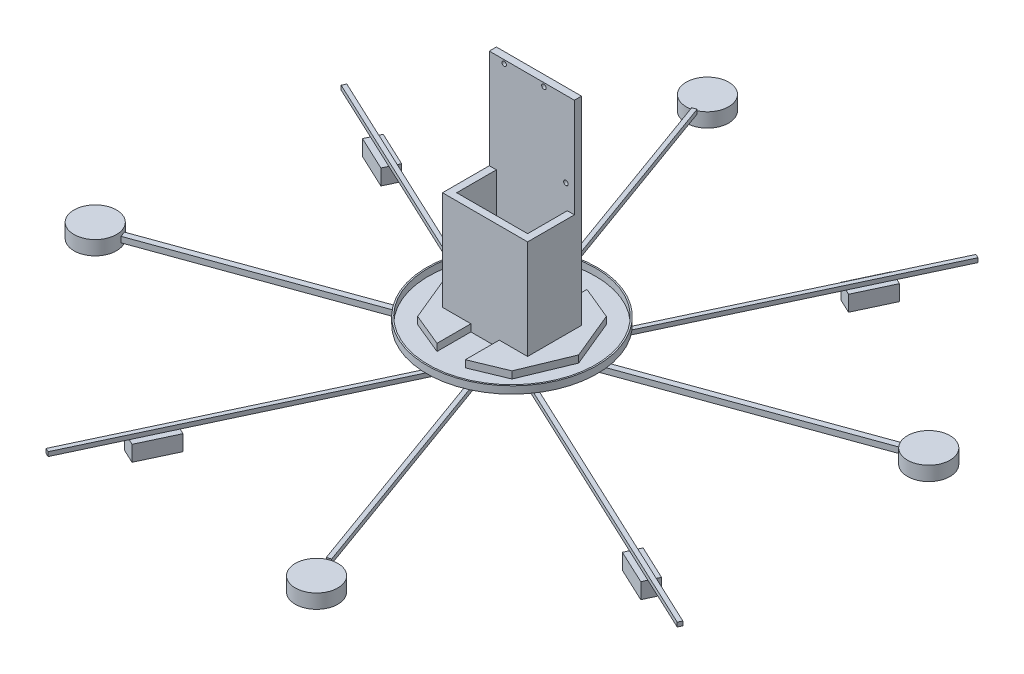
from build123d import *

# Parameters (mm, degrees)
CROQUIS1_W                 = 56
CROQUIS1_H                 = 34
CROQUIS1_W_2               = 50
CROQUIS1_H_2               = 28
SALIENTE_EXTRUIR1_DEPTH    = 5
CROQUIS2_W                 = 60
CROQUIS2_H                 = 38
CROQUIS2_W_2               = 50
CROQUIS2_H_2               = 28
SALIENTE_EXTRUIR2_DEPTH    = 70
CROQUIS4_W                 = 60
CROQUIS4_H                 = 5
SALIENTE_EXTRUIR4_DEPTH    = 70
CROQUIS5_R                 = 1.59
CORTAR_EXTRUIR1_DEPTH      = 165.203642607
CROQUIS6_W                 = 20
CROQUIS6_H                 = 30
CORTAR_EXTRUIR2_DEPTH      = 155.99942186
CROQUIS7_R                 = 60
SALIENTE_EXTRUIR5_DEPTH    = 0.1
CROQUIS9_W                 = 1
CROQUIS9_H                 = 5
SALIENTE_EXTRUIR6_DEPTH    = 0.2
SALIENTE_EXTRUIR7_DEPTH    = 22.1
CROQUIS12_W                = 3
CROQUIS12_H                = 3
SALIENTE_EXTRUIR8_DEPTH    = 197
CROQUIS13_W                = 3
CROQUIS13_H                = 3
SALIENTE_EXTRUIR9_DEPTH    = 197
CROQUIS14_W                = 4
CROQUIS14_H                = 4
SALIENTE_EXTRUIR10_DEPTH   = 197
CROQUIS15_W                = 4
CROQUIS15_H                = 4
SALIENTE_EXTRUIR12_DEPTH   = 197
CROQUIS17_R                = 15
SALIENTE_EXTRUIR13_DEPTH   = 10
SALIENTE_EXTRUIR13_2_DEPTH = 10
SALIENTE_EXTRUIR13_3_DEPTH = 10
SALIENTE_EXTRUIR13_4_DEPTH = 10
CROQUIS18_W                = 3
CROQUIS18_H                = 3
SALIENTE_EXTRUIR14_DEPTH   = 229
CROQUIS19_W                = 3
CROQUIS19_H                = 3
SALIENTE_EXTRUIR15_DEPTH   = 229
CROQUIS20_W                = 3
CROQUIS20_H                = 3
SALIENTE_EXTRUIR16_DEPTH   = 229
CROQUIS21_W                = 3
CROQUIS21_H                = 3
SALIENTE_EXTRUIR17_DEPTH   = 229
SALIENTE_EXTRUIR18_DEPTH   = 11


with BuildPart() as part:
    # Croquis1 → Saliente-Extruir1 (new body)
    # profile 1 of 3: a face of its own
    with BuildSketch(Plane(origin=(0, 0, 0), x_dir=(1, 0, 0), z_dir=(0, 1, 0))):
        Polygon((0, -47.036266736), (33.25966317, -33.25966317), (47.036266736, 0), (33.25966317, 33.25966317), (0, 47.036266736), (-33.25966317, 33.25966317), (-47.036266736, 0), (-33.25966317, -33.25966317), align=None)
        Rectangle(CROQUIS1_W, CROQUIS1_H, mode=Mode.SUBTRACT)
    # profile 2 of 3: a face of its own
    with BuildSketch(Plane(origin=(0, 0, 0), x_dir=(1, 0, 0), z_dir=(0, 1, 0))):
        Rectangle(CROQUIS1_W, CROQUIS1_H)
        Rectangle(CROQUIS1_W_2, CROQUIS1_H_2, mode=Mode.SUBTRACT)
    # profile 3 of 3: a face of its own
    with BuildSketch(Plane(origin=(0, 0, 0), x_dir=(1, 0, 0), z_dir=(0, 1, 0))):
        Rectangle(CROQUIS1_W_2, CROQUIS1_H_2)
    extrude(amount=SALIENTE_EXTRUIR1_DEPTH)

    # Croquis2 → Saliente-Extruir2 (add)
    with BuildSketch(Plane(origin=(0, 5, 0), x_dir=(1, 0, 0), z_dir=(0, 1, 0))):
        Rectangle(CROQUIS2_W, CROQUIS2_H)
        Rectangle(CROQUIS2_W_2, CROQUIS2_H_2, mode=Mode.SUBTRACT)
    extrude(amount=SALIENTE_EXTRUIR2_DEPTH)

    # Croquis4 → Saliente-Extruir4 (add)
    with BuildSketch(Plane(origin=(0, 75, 0), x_dir=(1, 0, 0), z_dir=(0, 1, 0))):
        with Locations((0, 16.5)):
            Rectangle(CROQUIS4_W, CROQUIS4_H)
    extrude(amount=SALIENTE_EXTRUIR4_DEPTH)

    # Croquis5 → Cortar-Extruir1 (cut, through all)
    with BuildSketch(Plane.XY.offset(-14)):
        with Locations((-19.5, 142.5)):
            Circle(CROQUIS5_R)
        with Locations((24, 91.5)):
            Circle(CROQUIS5_R)
        with Locations((8.5, 142.5)):
            Circle(CROQUIS5_R)
    extrude(amount=-CORTAR_EXTRUIR1_DEPTH, mode=Mode.SUBTRACT)

    # Croquis6 → Cortar-Extruir2 (cut, through all)
    with BuildSketch(Plane(origin=(0, 5, 0), x_dir=(1, 0, 0), z_dir=(0, 1, 0))):
        with Locations((0, 34)):
            Rectangle(CROQUIS6_W, CROQUIS6_H)
        with Locations((0, -34)):
            Rectangle(CROQUIS6_W, CROQUIS6_H)
    extrude(amount=-CORTAR_EXTRUIR2_DEPTH, mode=Mode.SUBTRACT)

    # Croquis7 → Saliente-Extruir5 (add)
    with BuildSketch(Plane.XZ):
        with Locations(Location((0, 0, 0), (0, 0, 270))):
            Circle(CROQUIS7_R)
    extrude(amount=SALIENTE_EXTRUIR5_DEPTH)

    # Croquis9 → Revolución1 (revolve)
    with BuildSketch(Plane.XY, mode=Mode.PRIVATE) as revoluci_n1_sk:
        with Locations((59.5, 2.5)):
            Rectangle(CROQUIS9_W, CROQUIS9_H)
    revolve(revoluci_n1_sk.sketch.rotate(Axis((0, 0, 0), (0, 1, 0)), 90), axis=Axis((0, 0, 0), (0, 1, 0)))

    # Croquis10 → Saliente-Extruir6 (add)
    with BuildSketch(Plane.XZ.offset(0.1)):
        Polygon((-21.963806256, 41.955403169), (-45.197706432, 14.136193744), (-41.955403169, -21.963806256), (-14.136193744, -45.197706432), (21.963806256, -41.955403169), (45.197706432, -14.136193744), (41.955403169, 21.963806256), (14.136193744, 45.197706432), align=None)
    extrude(amount=SALIENTE_EXTRUIR6_DEPTH)

    # Croquis11 → Saliente-Extruir7 (add)
    with BuildSketch(Plane.XZ.offset(0.3)):
        Polygon((-18.921877938, -0.869901338), (-12.764675068, -13.994901338), (0.869901338, -18.921877938), (13.994901338, -12.764675068), (18.921877938, 0.869901338), (12.764675068, 13.994901338), (-0.869901338, 18.921877938), (-13.994901338, 12.764675068), align=None)
    extrude(amount=SALIENTE_EXTRUIR7_DEPTH)

    # Croquis12 → Saliente-Extruir8 (add)
    with BuildSketch(Plane(origin=(5.947386865, 0, 16.458389638), x_dir=(0.9404794078882311, 0, -0.33985067800168073), z_dir=(0.33985067800168073, 0, 0.9404794078882311))):
        with Locations((-0.168076696, -6.9)):
            Rectangle(CROQUIS12_W, CROQUIS12_H)
    extrude(amount=SALIENTE_EXTRUIR8_DEPTH)

    # Croquis13 → Saliente-Extruir9 (add)
    with BuildSketch(Plane(origin=(-5.947386865, 0, -16.458389638), x_dir=(-0.9404794078882313, 0, 0.33985067800168045), z_dir=(-0.33985067800168045, 0, -0.9404794078882313))):
        with Locations((0.168076696, -6.9)):
            Rectangle(CROQUIS13_W, CROQUIS13_H)
    extrude(amount=SALIENTE_EXTRUIR9_DEPTH)

    # Croquis14 → Saliente-Extruir10 (add)
    with BuildSketch(Plane(origin=(-16.458389638, 0, 5.947386865), x_dir=(0.33985067800168045, 0, 0.9404794078882313), z_dir=(-0.9404794078882313, 0, 0.33985067800168045))):
        with Locations((-0.248737342, -11.4)):
            Rectangle(CROQUIS14_W, CROQUIS14_H)
    extrude(amount=SALIENTE_EXTRUIR10_DEPTH)

    # Croquis15 → Saliente-Extruir12 (add)
    with BuildSketch(Plane(origin=(16.458389638, 0, -5.947386865), x_dir=(-0.3398506780016804, 0, -0.9404794078882313), z_dir=(0.9404794078882313, 0, -0.3398506780016804))):
        with Locations((0.248737342, -11.4)):
            Rectangle(CROQUIS15_W, CROQUIS15_H)
    extrude(amount=SALIENTE_EXTRUIR12_DEPTH)

    # Croquis18 → Saliente-Extruir14 (add)
    with BuildSketch(Plane(origin=(7.432401338, 0, -15.843276503), x_dir=(-0.9053300858899115, 0, -0.4247086478782432), z_dir=(0.42470864787824314, 0, -0.9053300858899114))):
        with Locations((0, -18.9)):
            Rectangle(CROQUIS18_W, CROQUIS18_H)
    extrude(amount=SALIENTE_EXTRUIR14_DEPTH)

    # Croquis19 → Saliente-Extruir15 (add)
    with BuildSketch(Plane(origin=(-7.432401338, 0, 15.843276503), x_dir=(0.9053300858899115, 0, 0.42470864787824314), z_dir=(-0.42470864787824314, 0, 0.9053300858899115))):
        with Locations((0, -18.9)):
            Rectangle(CROQUIS19_W, CROQUIS19_H)
    extrude(amount=SALIENTE_EXTRUIR15_DEPTH)

    # Croquis20 → Saliente-Extruir16 (add)
    with BuildSketch(Plane(origin=(15.843276503, 0, 7.432401338), x_dir=(0.42470864787824314, 0, -0.9053300858899115), z_dir=(0.9053300858899115, 0, 0.42470864787824314))):
        with Locations((0, -18.9)):
            Rectangle(CROQUIS20_W, CROQUIS20_H)
    extrude(amount=SALIENTE_EXTRUIR16_DEPTH)

    # Croquis21 → Saliente-Extruir17 (add)
    with BuildSketch(Plane(origin=(-15.843276503, 0, -7.432401338), x_dir=(-0.4247086478782432, 0, 0.9053300858899115), z_dir=(-0.9053300858899114, 0, -0.42470864787824314))):
        with Locations((0, -18.9)):
            Rectangle(CROQUIS21_W, CROQUIS21_H)
    extrude(amount=SALIENTE_EXTRUIR17_DEPTH)

    # Croquis22 → Saliente-Extruir18 (add)
    with BuildSketch(Plane.XZ.offset(20.4)):
        Polygon((91.199799959, -181.99622308), (81.241169015, -186.668018206), (69.774035522, -162.224105887), (79.732666467, -157.552310761), align=None)
        Polygon((-157.552310761, -79.732666467), (-181.99622308, -91.199799959), (-186.668018206, -81.241169015), (-162.224105887, -69.774035522), align=None)
        Polygon((-79.732666467, 157.552310761), (-91.199799959, 181.99622308), (-81.241169015, 186.668018206), (-69.774035522, 162.224105887), align=None)
        Polygon((157.552310761, 79.732666467), (181.99622308, 91.199799959), (186.668018206, 81.241169015), (162.224105887, 69.774035522), align=None)
    extrude(amount=SALIENTE_EXTRUIR18_DEPTH)


with BuildPart() as body_2:
    # Croquis17 → Saliente-Extruir13 (new body)
    with BuildSketch(Plane(origin=(0, -6.4, 0), x_dir=(1, 0, 0), z_dir=(0, 1, 0))):
        with Locations(Location((-215.829723194, -78.024236649, 0), (0, 0, 270))):
            Circle(CROQUIS17_R)
    extrude(amount=-SALIENTE_EXTRUIR13_DEPTH)


with BuildPart() as body_3:
    # Croquis17 → Saliente-Extruir13 2 (new body)
    with BuildSketch(Plane(origin=(0, -6.4, 0), x_dir=(1, 0, 0), z_dir=(0, 1, 0))):
        with Locations(Location((-78.024236649, 215.829723194, 0), (0, 0, 270))):
            Circle(CROQUIS17_R)
    extrude(amount=-SALIENTE_EXTRUIR13_2_DEPTH)


with BuildPart() as body_4:
    # Croquis17 → Saliente-Extruir13 3 (new body)
    with BuildSketch(Plane(origin=(0, -6.4, 0), x_dir=(1, 0, 0), z_dir=(0, 1, 0))):
        with Locations(Location((215.829723194, 78.024236649, 0), (0, 0, 270))):
            Circle(CROQUIS17_R)
    extrude(amount=-SALIENTE_EXTRUIR13_3_DEPTH)


with BuildPart() as body_5:
    # Croquis17 → Saliente-Extruir13 4 (new body)
    with BuildSketch(Plane(origin=(0, -6.4, 0), x_dir=(1, 0, 0), z_dir=(0, 1, 0))):
        with Locations(Location((78.024236649, -215.829723194, 0), (0, 0, 270))):
            Circle(CROQUIS17_R)
    extrude(amount=-SALIENTE_EXTRUIR13_4_DEPTH)


solid = Compound([part.part, body_2.part, body_3.part, body_4.part, body_5.part])
